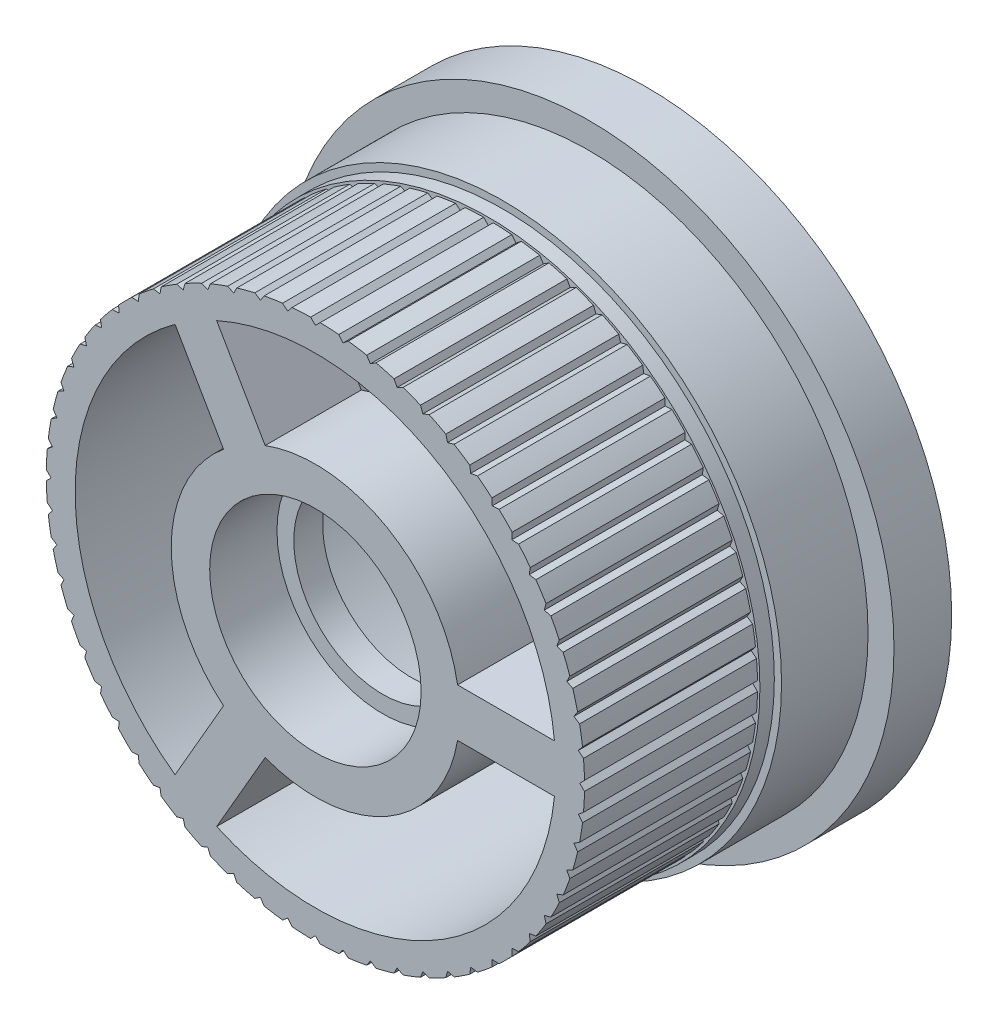
from build123d import *

# Parameters (mm, degrees)
SKETCH1_R           = 31.7
FLANGE_DEPTH        = 6
SKETCH2_R           = 29
THREAD_DEPTH        = 9
SKETCH3_R           = 28.25
RELIEF_DEPTH        = 1.5
SKETCH4_R           = 28
PILOT_DEPTH         = 18
SKETCH5_R           = 25
RING_BORE_DEPTH     = 34.5
SKETCH6_R           = 15
SKETCH6_R_2         = 9.25
HUB_DEPTH           = 10
SKETCH7_W           = 12
SKETCH7_H           = 5
SPOKES_DEPTH        = 10
SKETCH8_R           = 11
SKETCH8_R_2         = 9.25
BEARING_SEAT_DEPTH  = 7
CLICK_GROOVES_DEPTH = 18


with BuildPart() as part:
    # Sketch1 → Flange (new body)
    with BuildSketch(Plane.XY):
        Circle(SKETCH1_R)
    extrude(amount=FLANGE_DEPTH)

    # Sketch2 → Thread (add)
    with BuildSketch(Plane.XY.offset(6)):
        Circle(SKETCH2_R)
    extrude(amount=THREAD_DEPTH)

    # Sketch3 → Relief (add)
    with BuildSketch(Plane.XY.offset(15)):
        Circle(SKETCH3_R)
    extrude(amount=RELIEF_DEPTH)

    # Sketch4 → Pilot (add)
    with BuildSketch(Plane.XY.offset(16.5)):
        Circle(SKETCH4_R)
    extrude(amount=PILOT_DEPTH)

    # Sketch5 → Ring_bore (cut)
    with BuildSketch(Plane.XY):
        Circle(SKETCH5_R)
    extrude(amount=RING_BORE_DEPTH, mode=Mode.SUBTRACT)



with BuildPart() as body_2:
    # Sketch6 → Hub (new body)
    with BuildSketch(Plane.XY.offset(24.5)):
        Circle(SKETCH6_R)
        Circle(SKETCH6_R_2, mode=Mode.SUBTRACT)
    extrude(amount=HUB_DEPTH)


with BuildPart() as part_1:
    add(part.part)

    add(body_2.part)  # Spokes merges body 2
    # Sketch7 → Spokes (add)
    with BuildSketch(Plane.XY.offset(24.5)):
        with Locations((20, 0)):
            Rectangle(SKETCH7_W, SKETCH7_H)
        Polygon((-4.834936491, 13.374355653), (-10.834936491, 23.766660498), (-15.165063509, 21.266660498), (-9.165063509, 10.874355653), align=None)
        Polygon((-9.165063509, -10.874355653), (-15.165063509, -21.266660498), (-10.834936491, -23.766660498), (-4.834936491, -13.374355653), align=None)
    extrude(amount=SPOKES_DEPTH)

    # Sketch8 → Bearing_seat (cut)
    with BuildSketch(Plane.XY.offset(27.5)):
        Circle(SKETCH8_R)
        Circle(SKETCH8_R_2, mode=Mode.SUBTRACT)
    extrude(amount=BEARING_SEAT_DEPTH, mode=Mode.SUBTRACT)

    # Sketch9 → Click_grooves (cut)
    with BuildSketch(Plane.XY.offset(16.5)):
        Polygon((27.5, 0), (29, 1.5), (29, -1.5), align=None)
        Polygon((27.349352123, 2.87453274), (28.684342271, 4.523108278), (28.997927661, 1.539542592), align=None)
        Polygon((26.89905902, 5.717571497), (28.054412885, 7.496660435), (28.678147958, 4.562217633), align=None)
        Polygon((26.154054198, 8.497967345), (27.117113481, 10.388077611), (28.044164464, 7.534908062), align=None)
        Polygon((25.122500085, 11.185257685), (25.882713307, 13.165680836), (27.102923236, 10.425044463), align=None)
        Polygon((23.815698604, 13.75), (24.36473671, 15.799038106), (25.86473671, 13.200961894), align=None)
        Polygon((22.247967345, 16.164094438), (22.579814958, 18.259297808), (24.343170715, 15.832246825), align=None)
        Polygon((20.436482701, 18.401091675), (20.547504029, 20.519504823), (22.554895848, 18.290070346), align=None)
        Polygon((18.401091675, 20.436482701), (18.290070346, 22.554895848), (20.519504823, 20.547504029), align=None)
        Polygon((16.164094438, 22.247967345), (15.832246825, 24.343170715), (18.259297808, 22.579814958), align=None)
        Polygon((13.75, 23.815698604), (13.200961894, 25.86473671), (15.799038106, 24.36473671), align=None)
        Polygon((11.185257685, 25.122500085), (10.425044463, 27.102923236), (13.165680836, 25.882713307), align=None)
        Polygon((8.497967345, 26.154054198), (7.534908062, 28.044164464), (10.388077611, 27.117113481), align=None)
        Polygon((5.717571497, 26.89905902), (4.562217633, 28.678147958), (7.496660435, 28.054412885), align=None)
        Polygon((2.87453274, 27.349352123), (1.539542592, 28.997927661), (4.523108278, 28.684342271), align=None)
        Polygon((0, 27.5), (-1.5, 29), (1.5, 29), align=None)
        Polygon((-2.87453274, 27.349352123), (-4.523108278, 28.684342271), (-1.539542592, 28.997927661), align=None)
        Polygon((-5.717571497, 26.89905902), (-7.496660435, 28.054412885), (-4.562217633, 28.678147958), align=None)
        Polygon((-8.497967345, 26.154054198), (-10.388077611, 27.117113481), (-7.534908062, 28.044164464), align=None)
        Polygon((-11.185257685, 25.122500085), (-13.165680836, 25.882713307), (-10.425044463, 27.102923236), align=None)
        Polygon((-13.75, 23.815698604), (-15.799038106, 24.36473671), (-13.200961894, 25.86473671), align=None)
        Polygon((-16.164094438, 22.247967345), (-18.259297808, 22.579814958), (-15.832246825, 24.343170715), align=None)
        Polygon((-18.401091675, 20.436482701), (-20.519504823, 20.547504029), (-18.290070346, 22.554895848), align=None)
        Polygon((-20.436482701, 18.401091675), (-22.554895848, 18.290070346), (-20.547504029, 20.519504823), align=None)
        Polygon((-22.247967345, 16.164094438), (-24.343170715, 15.832246825), (-22.579814958, 18.259297808), align=None)
        Polygon((-23.815698604, 13.75), (-25.86473671, 13.200961894), (-24.36473671, 15.799038106), align=None)
        Polygon((-25.122500085, 11.185257685), (-27.102923236, 10.425044463), (-25.882713307, 13.165680836), align=None)
        Polygon((-26.154054198, 8.497967345), (-28.044164464, 7.534908062), (-27.117113481, 10.388077611), align=None)
        Polygon((-26.89905902, 5.717571497), (-28.678147958, 4.562217633), (-28.054412885, 7.496660435), align=None)
        Polygon((-27.349352123, 2.87453274), (-28.997927661, 1.539542592), (-28.684342271, 4.523108278), align=None)
        Polygon((-27.5, 0), (-29, -1.5), (-29, 1.5), align=None)
        Polygon((-27.349352123, -2.87453274), (-28.684342271, -4.523108278), (-28.997927661, -1.539542592), align=None)
        Polygon((-26.89905902, -5.717571497), (-28.054412885, -7.496660435), (-28.678147958, -4.562217633), align=None)
        Polygon((-26.154054198, -8.497967345), (-27.117113481, -10.388077611), (-28.044164464, -7.534908062), align=None)
        Polygon((-25.122500085, -11.185257685), (-25.882713307, -13.165680836), (-27.102923236, -10.425044463), align=None)
        Polygon((-23.815698604, -13.75), (-24.36473671, -15.799038106), (-25.86473671, -13.200961894), align=None)
        Polygon((-22.247967345, -16.164094438), (-22.579814958, -18.259297808), (-24.343170715, -15.832246825), align=None)
        Polygon((-20.436482701, -18.401091675), (-20.547504029, -20.519504823), (-22.554895848, -18.290070346), align=None)
        Polygon((-18.401091675, -20.436482701), (-18.290070346, -22.554895848), (-20.519504823, -20.547504029), align=None)
        Polygon((-16.164094438, -22.247967345), (-15.832246825, -24.343170715), (-18.259297808, -22.579814958), align=None)
        Polygon((-13.75, -23.815698604), (-13.200961894, -25.86473671), (-15.799038106, -24.36473671), align=None)
        Polygon((-11.185257685, -25.122500085), (-10.425044463, -27.102923236), (-13.165680836, -25.882713307), align=None)
        Polygon((-8.497967345, -26.154054198), (-7.534908062, -28.044164464), (-10.388077611, -27.117113481), align=None)
        Polygon((-5.717571497, -26.89905902), (-4.562217633, -28.678147958), (-7.496660435, -28.054412885), align=None)
        Polygon((-2.87453274, -27.349352123), (-1.539542592, -28.997927661), (-4.523108278, -28.684342271), align=None)
        Polygon((0, -27.5), (1.5, -29), (-1.5, -29), align=None)
        Polygon((2.87453274, -27.349352123), (4.523108278, -28.684342271), (1.539542592, -28.997927661), align=None)
        Polygon((5.717571497, -26.89905902), (7.496660435, -28.054412885), (4.562217633, -28.678147958), align=None)
        Polygon((8.497967345, -26.154054198), (10.388077611, -27.117113481), (7.534908062, -28.044164464), align=None)
        Polygon((11.185257685, -25.122500085), (13.165680836, -25.882713307), (10.425044463, -27.102923236), align=None)
        Polygon((13.75, -23.815698604), (15.799038106, -24.36473671), (13.200961894, -25.86473671), align=None)
        Polygon((16.164094438, -22.247967345), (18.259297808, -22.579814958), (15.832246825, -24.343170715), align=None)
        Polygon((18.401091675, -20.436482701), (20.519504823, -20.547504029), (18.290070346, -22.554895848), align=None)
        Polygon((20.436482701, -18.401091675), (22.554895848, -18.290070346), (20.547504029, -20.519504823), align=None)
        Polygon((22.247967345, -16.164094438), (24.343170715, -15.832246825), (22.579814958, -18.259297808), align=None)
        Polygon((23.815698604, -13.75), (25.86473671, -13.200961894), (24.36473671, -15.799038106), align=None)
        Polygon((25.122500085, -11.185257685), (27.102923236, -10.425044463), (25.882713307, -13.165680836), align=None)
        Polygon((26.154054198, -8.497967345), (28.044164464, -7.534908062), (27.117113481, -10.388077611), align=None)
        Polygon((26.89905902, -5.717571497), (28.678147958, -4.562217633), (28.054412885, -7.496660435), align=None)
        Polygon((27.349352123, -2.87453274), (28.997927661, -1.539542592), (28.684342271, -4.523108278), align=None)
    extrude(amount=CLICK_GROOVES_DEPTH, mode=Mode.SUBTRACT)


solid = part_1.part
